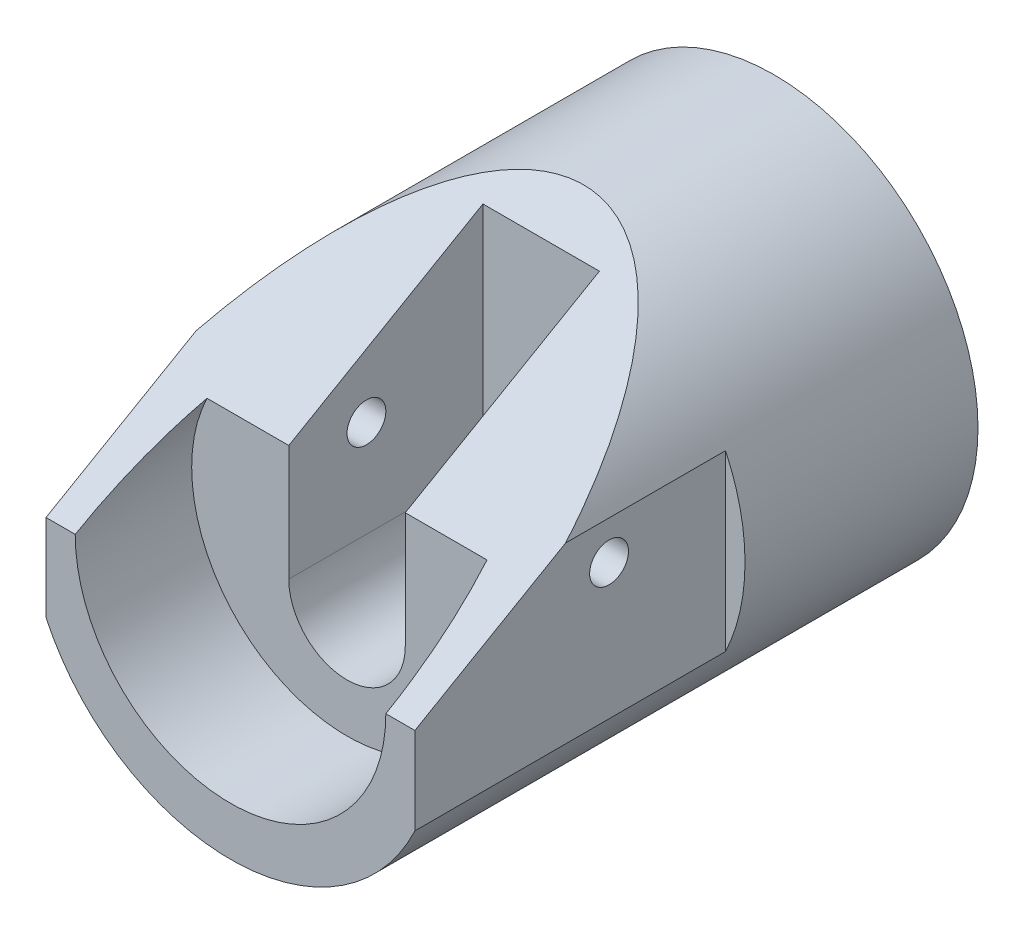
from build123d import *

# Parameters (mm, degrees)
CROQUIS2_W              = 66.675
CROQUIS2_H              = 66.675
SALIENTE_EXTRUIR2_DEPTH = 88.9
CORTAR_EXTRUIR1_DEPTH   = 117.01790608
CROQUIS4_R              = 25.4
CORTAR_EXTRUIR2_DEPTH   = 19.05
CORTAR_EXTRUIR3_DEPTH   = 31.75
CROQUIS6_OUTSIDE_W      = 94.593
CROQUIS6_OUTSIDE_H      = 94.593
CROQUIS6_OUTSIDE_R      = 33.3375
CORTAR_EXTRUIR5_DEPTH   = 101.627967348
CORTAR_EXTRUIR6_DEPTH   = 50.8
CROQUIS9_R              = 3.175
CORTAR_EXTRUIR7_DEPTH   = 60.325


with BuildPart() as part:
    # Croquis2 → Saliente-Extruir2 (new body)
    with BuildSketch(Plane.XY):
        Rectangle(CROQUIS2_W, CROQUIS2_H)
    extrude(amount=SALIENTE_EXTRUIR2_DEPTH)

    # Croquis3 → Cortar-Extruir1 (cut, through all)
    with BuildSketch(Plane(origin=(33.3375, 0, 0), x_dir=(0, 0, -1), z_dir=(1, 0, 0))):
        Polygon((-88.9, 0), (-88.9, 33.3375), (-31.157756203, 33.3375), align=None)
    extrude(amount=-CORTAR_EXTRUIR1_DEPTH, mode=Mode.SUBTRACT)

    # Croquis4 → Cortar-Extruir2 (cut)
    with BuildSketch(Plane.XY.offset(88.9)):
        Circle(CROQUIS4_R)
    extrude(amount=-CORTAR_EXTRUIR2_DEPTH, mode=Mode.SUBTRACT)

    # Croquis5 → Cortar-Extruir3 (cut)
    with BuildSketch(Plane.XY.offset(69.85)):
        with BuildLine():
            Line((-9.525, -7.9248), (-9.525, 33.3375))
            Line((-9.525, 33.3375), (9.525, 33.3375))
            Line((9.525, 33.3375), (9.525, -7.9248))
            ThreePointArc((9.525, -7.9248), (0, -17.4498), (-9.525, -7.9248))
        make_face()
    extrude(amount=-CORTAR_EXTRUIR3_DEPTH, mode=Mode.SUBTRACT)

    # Croquis6 outside → Cortar-Extruir5 (cut, through all)
    with BuildSketch(Plane.XY.offset(88.9)):
        with Locations((0.0005, 0.0005)):
            Rectangle(CROQUIS6_OUTSIDE_W, CROQUIS6_OUTSIDE_H)
        Circle(CROQUIS6_OUTSIDE_R, mode=Mode.SUBTRACT)
    extrude(amount=-CORTAR_EXTRUIR5_DEPTH, mode=Mode.SUBTRACT)

    # Croquis8 → Cortar-Extruir6 (cut)
    with BuildSketch(Plane.XY.offset(88.9)):
        with BuildLine():
            Line((-30.1752, 14.172022128), (-30.1752, -14.172022128))
            ThreePointArc((-30.1752, -14.172022128), (-33.3375, 0), (-30.1752, 14.172022128))
        make_face()
        with BuildLine():
            Line((30.1498, 14.225978568), (30.1498, -14.225978568))
            ThreePointArc((30.1498, -14.225978568), (33.3375, 0), (30.1498, 14.225978568))
        make_face()
    extrude(amount=-CORTAR_EXTRUIR6_DEPTH, mode=Mode.SUBTRACT)

    # Croquis9 → Cortar-Extruir7 (cut)
    with BuildSketch(Plane(origin=(30.1498, 0, 0), x_dir=(0, 0, -1), z_dir=(1, 0, 0))):
        with Locations((-57.15, 7.9248)):
            Circle(CROQUIS9_R)
    extrude(amount=-CORTAR_EXTRUIR7_DEPTH, mode=Mode.SUBTRACT)


solid = part.part
